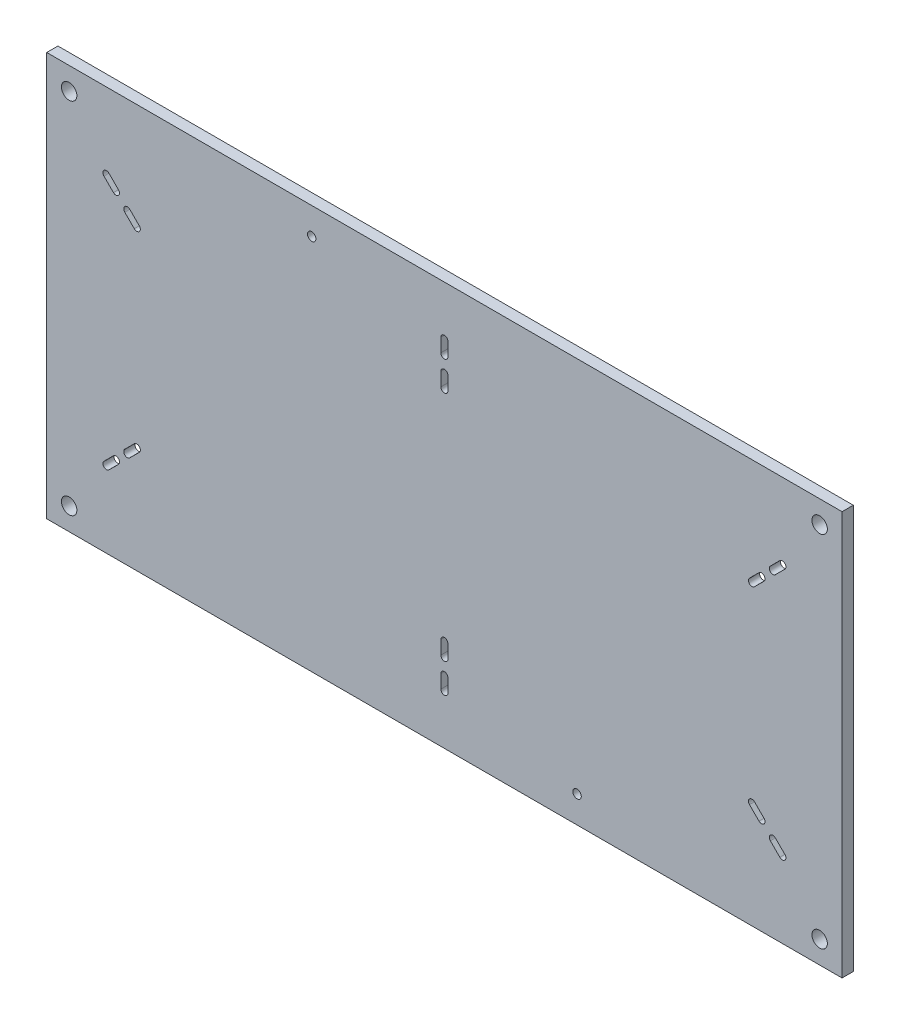
from build123d import *

# Parameters (mm, degrees)
SKETCH1_W           = 450.2
SKETCH1_H           = 228.6
BOSS_EXTRUDE1_DEPTH = 6.35
CORNER_SLOTS_DEPTH  = 10
FOOT_HOLES_1_4_20_D = 8.7376
ESD_FASTERNERS_D    = 4.7625
MIDDLE_SLOTS_DEPTH  = 10


with BuildPart() as part:
    # Sketch1 → Boss-Extrude1 (new body)
    with BuildSketch(Plane.XY):
        Rectangle(SKETCH1_W, SKETCH1_H)
    extrude(amount=BOSS_EXTRUDE1_DEPTH)

    # Sketch3 → Corner Slots (cut)
    with BuildSketch(Plane.XY.offset(6.35)):
        with BuildLine():
            ThreePointArc((-180.908290444, 58.084863229), (-180.908290444, 60.913290444), (-178.079863229, 60.913290444))
            Line((-178.079863229, 60.913290444), (-172.691709556, 55.525136771))
            ThreePointArc((-172.691709556, 55.525136771), (-172.691709556, 52.696709556), (-175.520136771, 52.696709556))
            Line((-175.520136771, 52.696709556), (-180.908290444, 58.084863229))
        make_face()
        with BuildLine():
            ThreePointArc((-184.500392892, 67.333820108), (-184.500392892, 64.505392892), (-187.328820108, 64.505392892))
            Line((-187.328820108, 64.505392892), (-192.71697378, 69.893546565))
            ThreePointArc((-192.71697378, 69.893546565), (-192.71697378, 72.72197378), (-189.888546565, 72.72197378))
            Line((-189.888546565, 72.72197378), (-184.500392892, 67.333820108))
        make_face()
        with BuildLine():
            Line((189.888546565, 72.72197378), (184.500392892, 67.333820108))
            ThreePointArc((184.500392892, 67.333820108), (184.500392892, 64.505392892), (187.328820108, 64.505392892))
            Line((187.328820108, 64.505392892), (192.71697378, 69.893546565))
            ThreePointArc((192.71697378, 69.893546565), (192.71697378, 72.72197378), (189.888546565, 72.72197378))
        make_face()
        with BuildLine():
            Line((175.520136771, 52.696709556), (180.908290444, 58.084863229))
            ThreePointArc((180.908290444, 58.084863229), (180.908290444, 60.913290444), (178.079863229, 60.913290444))
            Line((178.079863229, 60.913290444), (172.691709556, 55.525136771))
            ThreePointArc((172.691709556, 55.525136771), (172.691709556, 52.696709556), (175.520136771, 52.696709556))
        make_face()
        with BuildLine():
            ThreePointArc((184.500392892, -67.333820108), (184.500392892, -64.505392892), (187.328820108, -64.505392892))
            Line((187.328820108, -64.505392892), (192.71697378, -69.893546565))
            ThreePointArc((192.71697378, -69.893546565), (192.71697378, -72.72197378), (189.888546565, -72.72197378))
            Line((189.888546565, -72.72197378), (184.500392892, -67.333820108))
        make_face()
        with BuildLine():
            ThreePointArc((180.908290444, -58.084863229), (180.908290444, -60.913290444), (178.079863229, -60.913290444))
            Line((178.079863229, -60.913290444), (172.691709556, -55.525136771))
            ThreePointArc((172.691709556, -55.525136771), (172.691709556, -52.696709556), (175.520136771, -52.696709556))
            Line((175.520136771, -52.696709556), (180.908290444, -58.084863229))
        make_face()
        with BuildLine():
            Line((-172.691709556, -55.525136771), (-178.079863229, -60.913290444))
            ThreePointArc((-178.079863229, -60.913290444), (-180.908290444, -60.913290444), (-180.908290444, -58.084863229))
            Line((-180.908290444, -58.084863229), (-175.520136771, -52.696709556))
            ThreePointArc((-175.520136771, -52.696709556), (-172.691709556, -52.696709556), (-172.691709556, -55.525136771))
        make_face()
        with BuildLine():
            Line((-189.888546565, -72.72197378), (-184.500392892, -67.333820108))
            ThreePointArc((-184.500392892, -67.333820108), (-184.500392892, -64.505392892), (-187.328820108, -64.505392892))
            Line((-187.328820108, -64.505392892), (-192.71697378, -69.893546565))
            ThreePointArc((-192.71697378, -69.893546565), (-192.71697378, -72.72197378), (-189.888546565, -72.72197378))
        make_face()
    extrude(amount=-CORNER_SLOTS_DEPTH, mode=Mode.SUBTRACT)

    # Foot Holes 1/4-20 (through all)
    with Locations(Plane.XY.offset(6.35)):
        with Locations((-212.4, 101.6), (-212.4, -101.6)):
            foot_holes_1_4_20 = Hole(FOOT_HOLES_1_4_20_D / 2)

    # Mirror2: Foot Holes 1/4-20 across plane
    add(foot_holes_1_4_20.mirror(Plane(origin=(0, 0, 0), x_dir=(0, 0, 1), z_dir=(1, 0, 0))), mode=Mode.SUBTRACT)

    # ESD Fasterners (through all)
    with Locations(Plane.XY.offset(6.35)):
        with Locations((-75.1, 99.09), (75.1, -99.089)):
            Hole(ESD_FASTERNERS_D / 2)

    # Sketch16 → Middle Slots (cut)
    with BuildSketch(Plane.XY):
        with BuildLine():
            Line((2, -78.63), (2, -86.25))
            ThreePointArc((2, -86.25), (0, -88.25), (-2, -86.25))
            Line((-2, -86.25), (-2, -78.63))
            ThreePointArc((-2, -78.63), (0, -76.63), (2, -78.63))
        make_face()
        with BuildLine():
            Line((-2, -69.55), (-2, -61.93))
            ThreePointArc((-2, -61.93), (0, -59.93), (2, -61.93))
            Line((2, -61.93), (2, -69.55))
            ThreePointArc((2, -69.55), (0, -71.55), (-2, -69.55))
        make_face()
        with BuildLine():
            Line((2, 78.63), (2, 86.25))
            ThreePointArc((2, 86.25), (0, 88.25), (-2, 86.25))
            Line((-2, 86.25), (-2, 78.63))
            ThreePointArc((-2, 78.63), (0, 76.63), (2, 78.63))
        make_face()
        with BuildLine():
            Line((-2, 69.55), (-2, 61.93))
            ThreePointArc((-2, 61.93), (0, 59.93), (2, 61.93))
            Line((2, 61.93), (2, 69.55))
            ThreePointArc((2, 69.55), (0, 71.55), (-2, 69.55))
        make_face()
    extrude(amount=MIDDLE_SLOTS_DEPTH, mode=Mode.SUBTRACT)


solid = part.part
